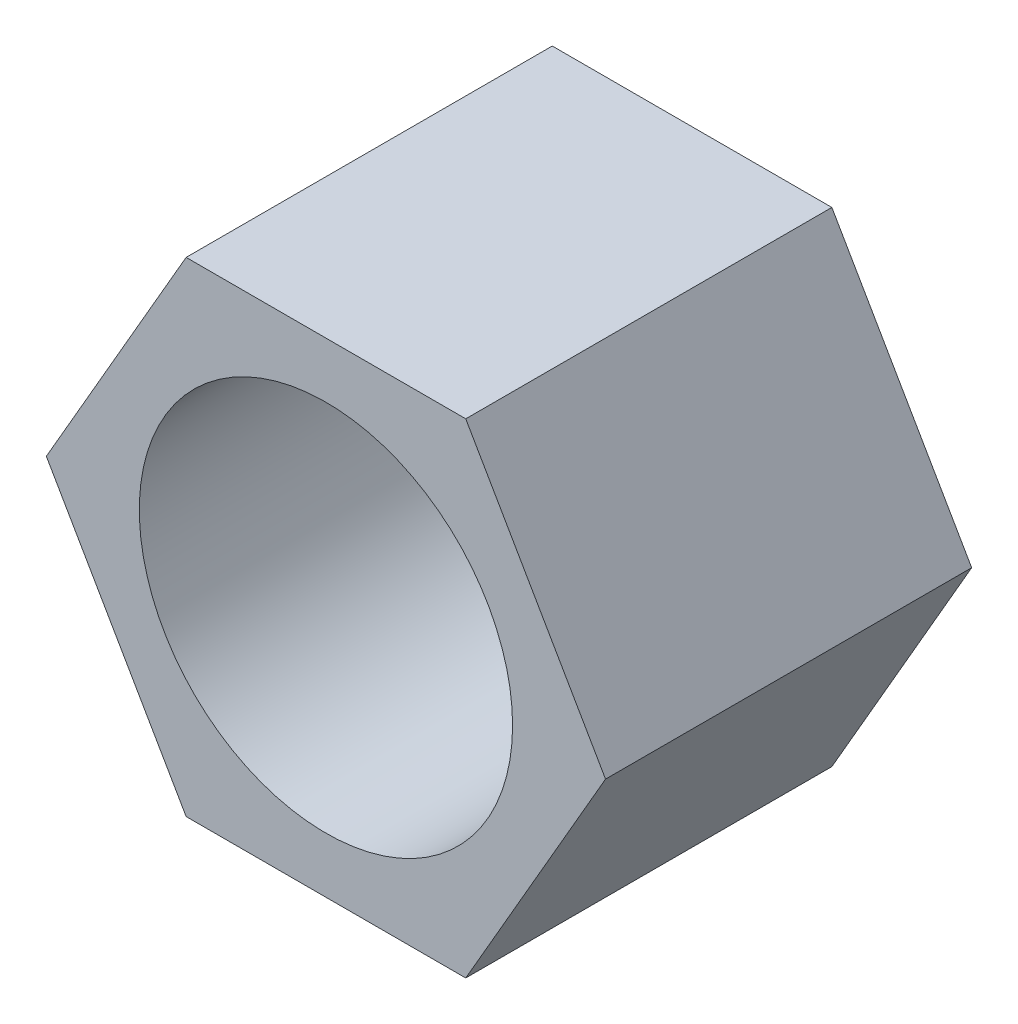
from build123d import *

# Parameters (mm, degrees)
BOSS_EXTRUDE1_DEPTH = 7.2009
SKETCH12_R          = 3.571875
CUT_EXTRUDE2_DEPTH  = 3.175
SKETCH11_R          = 7.34187
CUT_EXTRUDE3_DEPTH  = 11.2268


with BuildPart() as part:
    # Sketch1 → Boss-Extrude1 (new, symmetric)
    with BuildSketch(Plane.XY):
        Polygon((10.998522628, 0), (5.499261314, 9.525), (-5.499261314, 9.525), (-10.998522628, 0), (-5.499261314, -9.525), (5.499261314, -9.525), align=None)
    extrude(amount=BOSS_EXTRUDE1_DEPTH, both=True)

    # Sketch12 → Cut-Extrude2 (cut)
    with BuildSketch(Plane(origin=(0, 0, -7.2009), x_dir=(-1, 0, 0), z_dir=(0, 0, -1))):
        Circle(SKETCH12_R)
    extrude(amount=-CUT_EXTRUDE2_DEPTH, mode=Mode.SUBTRACT)

    # Sketch11 → Cut-Extrude3 (cut)
    with BuildSketch(Plane.XY.offset(7.2009)):
        Circle(SKETCH11_R)
    extrude(amount=-CUT_EXTRUDE3_DEPTH, mode=Mode.SUBTRACT)


solid = part.part
